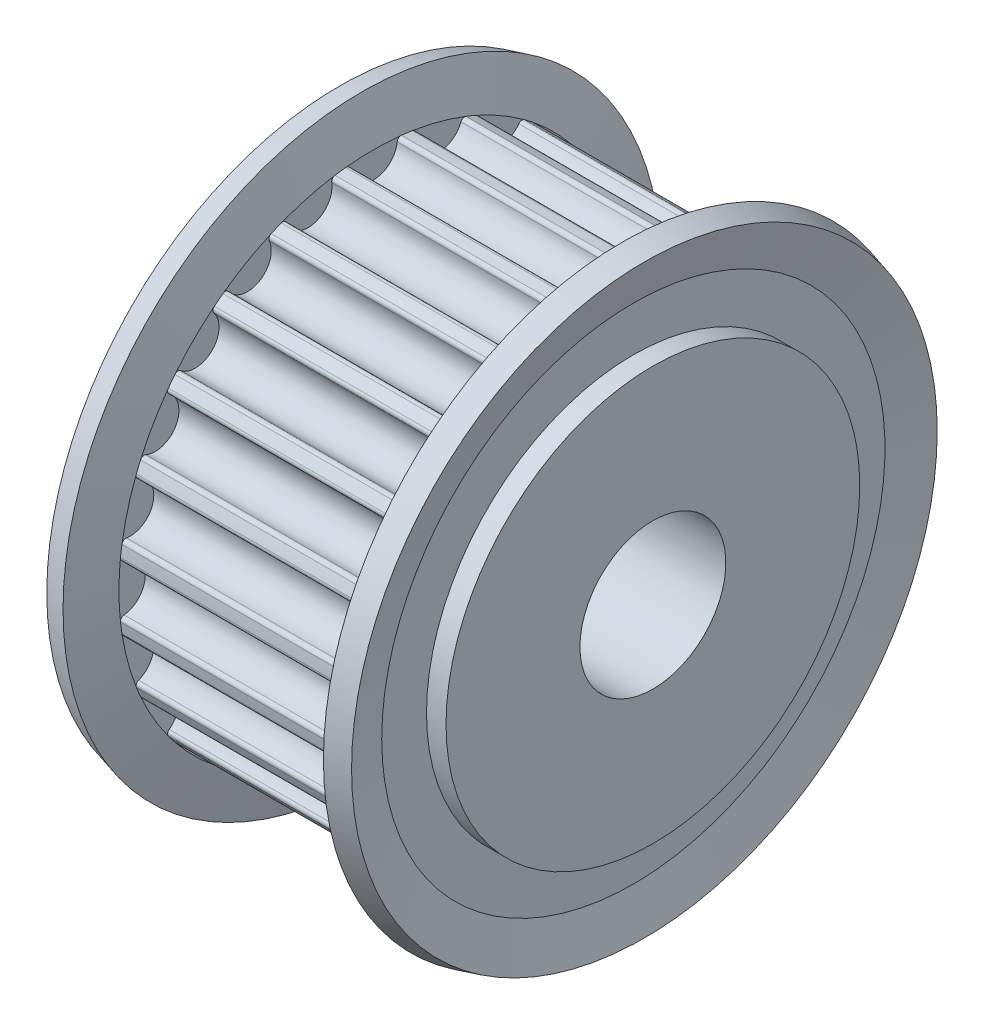
from build123d import *

# Parameters (mm, degrees)
CUT_EXTRUDE1_DEPTH       = 5.15
CUT_EXTRUDE1_DEPTH_BACK  = 5.15
CUT_EXTRUDE2_DEPTH       = 5.15
CUT_EXTRUDE2_DEPTH_BACK  = 5.15
CUT_EXTRUDE3_DEPTH       = 5.15
CUT_EXTRUDE3_DEPTH_BACK  = 5.15
CUT_EXTRUDE4_DEPTH       = 5.15
CUT_EXTRUDE4_DEPTH_BACK  = 5.15
CUT_EXTRUDE5_DEPTH       = 5.15
CUT_EXTRUDE5_DEPTH_BACK  = 5.15
CUT_EXTRUDE6_DEPTH       = 5.15
CUT_EXTRUDE6_DEPTH_BACK  = 5.15
CUT_EXTRUDE7_DEPTH       = 5.15
CUT_EXTRUDE7_DEPTH_BACK  = 5.15
CUT_EXTRUDE8_DEPTH       = 5.15
CUT_EXTRUDE8_DEPTH_BACK  = 5.15
CUT_EXTRUDE9_DEPTH       = 5.15
CUT_EXTRUDE9_DEPTH_BACK  = 5.15
CUT_EXTRUDE10_DEPTH      = 5.15
CUT_EXTRUDE10_DEPTH_BACK = 5.15
CUT_EXTRUDE11_DEPTH      = 5.15
CUT_EXTRUDE11_DEPTH_BACK = 5.15
CUT_EXTRUDE12_DEPTH      = 5.15
CUT_EXTRUDE12_DEPTH_BACK = 5.15
CUT_EXTRUDE13_DEPTH      = 5.15
CUT_EXTRUDE13_DEPTH_BACK = 5.15
CUT_EXTRUDE14_DEPTH      = 5.15
CUT_EXTRUDE14_DEPTH_BACK = 5.15
CUT_EXTRUDE15_DEPTH      = 5.15
CUT_EXTRUDE15_DEPTH_BACK = 5.15
CUT_EXTRUDE16_DEPTH      = 5.15
CUT_EXTRUDE16_DEPTH_BACK = 5.15
CUT_EXTRUDE17_DEPTH      = 5.15
CUT_EXTRUDE17_DEPTH_BACK = 5.15
CUT_EXTRUDE18_DEPTH      = 5.15
CUT_EXTRUDE18_DEPTH_BACK = 5.15
CUT_EXTRUDE19_DEPTH      = 5.15
CUT_EXTRUDE19_DEPTH_BACK = 5.15
CUT_EXTRUDE20_DEPTH      = 5.15
CUT_EXTRUDE20_DEPTH_BACK = 5.15
CUT_EXTRUDE21_DEPTH      = 5.15
CUT_EXTRUDE21_DEPTH_BACK = 5.15
CUT_EXTRUDE22_DEPTH      = 5.15
CUT_EXTRUDE22_DEPTH_BACK = 5.15
CUT_EXTRUDE23_DEPTH      = 5.15
CUT_EXTRUDE23_DEPTH_BACK = 5.15
CUT_EXTRUDE24_DEPTH      = 5.15
CUT_EXTRUDE24_DEPTH_BACK = 5.15
SKETCH26_W               = 14
SKETCH26_H               = 3.175


with BuildPart() as part:
    # Sketch1 → Revolve1 (revolve)
    with BuildSketch(Plane.XY):
        Polygon((0, 0), (0, 9), (0.85, 9), (0.85, 10.948347502), (0.369611724, 12.741180955), (1.335537551, 13), (1.85, 11.08), (12.15, 11.08), (12.664462449, 13), (13.630388276, 12.741180955), (13.15, 10.948347502), (13.15, 9), (14, 9), (14, 0), align=None)
    revolve(axis=Axis((14, 0, 0), (-1, 0, 0)))

    # Sketch2 → Cut-Extrude1 (cut, two sides: drawn at the far end of the back side and taken through both)
    with BuildSketch(Plane(origin=(7, 0, 0), x_dir=(0, 0, -1), z_dir=(1, 0, 0)).offset(-CUT_EXTRUDE1_DEPTH_BACK)):
        with BuildLine():
            Line((-1.253585937, 11.391230061), (-1.212018515, 11.01351039))
            ThreePointArc((-1.212018515, 11.01351039), (-1.086763232, 10.976907979), (-1.024354367, 10.862305378))
            ThreePointArc((-1.024354367, 10.862305378), (0, 9.94), (1.024354367, 10.862305378))
            ThreePointArc((1.024354367, 10.862305378), (1.086763232, 10.976907979), (1.212018515, 11.01351039))
            Line((1.212018515, 11.01351039), (1.253585937, 11.391230061))
            ThreePointArc((1.253585937, 11.391230061), (0, 11.46), (-1.253585937, 11.391230061))
        make_face()
    extrude(amount=CUT_EXTRUDE1_DEPTH + CUT_EXTRUDE1_DEPTH_BACK, mode=Mode.SUBTRACT)

    # Sketch3 → Cut-Extrude2 (cut, two sides: drawn at the far end of the back side and taken through both)
    with BuildSketch(Plane(origin=(7, 0, 0), x_dir=(0, 0, -1), z_dir=(1, 0, 0)).offset(-CUT_EXTRUDE2_DEPTH_BACK)):
        with BuildLine():
            Line((-4.159138319, 10.678631394), (-4.021226228, 10.324540649))
            ThreePointArc((-4.021226228, 10.324540649), (-3.890765514, 10.321603888), (-3.800821844, 10.227058879))
            ThreePointArc((-3.800821844, 10.227058879), (-2.572661308, 9.601302713), (-1.821921168, 10.757303717))
            ThreePointArc((-1.821921168, 10.757303717), (-1.791300169, 10.884153932), (-1.679786257, 10.951927599))
            Line((-1.679786257, 10.951927599), (-1.737396255, 11.327535224))
            ThreePointArc((-1.737396255, 11.327535224), (-2.966066257, 11.069509969), (-4.159138319, 10.678631394))
        make_face()
    extrude(amount=CUT_EXTRUDE2_DEPTH + CUT_EXTRUDE2_DEPTH_BACK, mode=Mode.SUBTRACT)

    # Sketch4 → Cut-Extrude3 (cut, two sides: drawn at the far end of the back side and taken through both)
    with BuildSketch(Plane(origin=(7, 0, 0), x_dir=(0, 0, -1), z_dir=(1, 0, 0)).offset(-CUT_EXTRUDE3_DEPTH_BACK)):
        with BuildLine():
            Line((-6.781252298, 9.238301645), (-6.556394019, 8.931970525))
            ThreePointArc((-6.556394019, 8.931970525), (-6.429618556, 8.962899549), (-6.318269593, 8.894855218))
            ThreePointArc((-6.318269593, 8.894855218), (-4.97, 8.608292514), (-4.544035785, 9.919209585))
            ThreePointArc((-4.544035785, 9.919209585), (-4.547289423, 10.049662781), (-4.457116371, 10.14398904))
            Line((-4.457116371, 10.14398904), (-4.609977763, 10.491887582))
            ThreePointArc((-4.609977763, 10.491887582), (-5.73, 9.924651127), (-6.781252298, 9.238301645))
        make_face()
    extrude(amount=CUT_EXTRUDE3_DEPTH + CUT_EXTRUDE3_DEPTH_BACK, mode=Mode.SUBTRACT)

    # Sketch5 → Cut-Extrude4 (cut, two sides: drawn at the far end of the back side and taken through both)
    with BuildSketch(Plane(origin=(7, 0, 0), x_dir=(0, 0, -1), z_dir=(1, 0, 0)).offset(-CUT_EXTRUDE4_DEPTH_BACK)):
        with BuildLine():
            Line((-8.941235139, 7.168396905), (-8.644754393, 6.930701371))
            ThreePointArc((-8.644754393, 6.930701371), (-8.530303719, 6.993388418), (-8.405137711, 6.956481873))
            ThreePointArc((-8.405137711, 6.956481873), (-7.028641405, 7.028641405), (-6.956481873, 8.405137711))
            ThreePointArc((-6.956481873, 8.405137711), (-6.993388418, 8.530303719), (-6.930701371, 8.644754393))
            Line((-6.930701371, 8.644754393), (-7.168396905, 8.941235139))
            ThreePointArc((-7.168396905, 8.941235139), (-8.103443712, 8.103443712), (-8.941235139, 7.168396905))
        make_face()
    extrude(amount=CUT_EXTRUDE4_DEPTH + CUT_EXTRUDE4_DEPTH_BACK, mode=Mode.SUBTRACT)

    # Sketch6 → Cut-Extrude5 (cut, two sides: drawn at the far end of the back side and taken through both)
    with BuildSketch(Plane(origin=(7, 0, 0), x_dir=(0, 0, -1), z_dir=(1, 0, 0)).offset(-CUT_EXTRUDE5_DEPTH_BACK)):
        with BuildLine():
            Line((-10.491887582, 4.609977763), (-10.14398904, 4.457116371))
            ThreePointArc((-10.14398904, 4.457116371), (-10.049662781, 4.547289423), (-9.919209585, 4.544035785))
            ThreePointArc((-9.919209585, 4.544035785), (-8.608292514, 4.97), (-8.894855218, 6.318269593))
            ThreePointArc((-8.894855218, 6.318269593), (-8.962899549, 6.429618556), (-8.931970525, 6.556394019))
            Line((-8.931970525, 6.556394019), (-9.238301645, 6.781252298))
            ThreePointArc((-9.238301645, 6.781252298), (-9.924651127, 5.73), (-10.491887582, 4.609977763))
        make_face()
    extrude(amount=CUT_EXTRUDE5_DEPTH + CUT_EXTRUDE5_DEPTH_BACK, mode=Mode.SUBTRACT)

    # Sketch7 → Cut-Extrude6 (cut, two sides: drawn at the far end of the back side and taken through both)
    with BuildSketch(Plane(origin=(7, 0, 0), x_dir=(0, 0, -1), z_dir=(1, 0, 0)).offset(-CUT_EXTRUDE6_DEPTH_BACK)):
        with BuildLine():
            Line((-11.327535224, 1.737396255), (-10.951927599, 1.679786257))
            ThreePointArc((-10.951927599, 1.679786257), (-10.884153932, 1.791300169), (-10.757303717, 1.821921168))
            ThreePointArc((-10.757303717, 1.821921168), (-9.601302713, 2.572661308), (-10.227058879, 3.800821844))
            ThreePointArc((-10.227058879, 3.800821844), (-10.321603888, 3.890765514), (-10.324540649, 4.021226228))
            Line((-10.324540649, 4.021226228), (-10.678631394, 4.159138319))
            ThreePointArc((-10.678631394, 4.159138319), (-11.069509969, 2.966066257), (-11.327535224, 1.737396255))
        make_face()
    extrude(amount=CUT_EXTRUDE6_DEPTH + CUT_EXTRUDE6_DEPTH_BACK, mode=Mode.SUBTRACT)

    # Sketch8 → Cut-Extrude7 (cut, two sides: drawn at the far end of the back side and taken through both)
    with BuildSketch(Plane(origin=(7, 0, 0), x_dir=(0, 0, -1), z_dir=(1, 0, 0)).offset(-CUT_EXTRUDE7_DEPTH_BACK)):
        with BuildLine():
            Line((-11.391230061, -1.253585937), (-11.01351039, -1.212018515))
            ThreePointArc((-11.01351039, -1.212018515), (-10.976907979, -1.086763232), (-10.862305378, -1.024354367))
            ThreePointArc((-10.862305378, -1.024354367), (-9.94, 0), (-10.862305378, 1.024354367))
            ThreePointArc((-10.862305378, 1.024354367), (-10.976907979, 1.086763232), (-11.01351039, 1.212018515))
            Line((-11.01351039, 1.212018515), (-11.391230061, 1.253585937))
            ThreePointArc((-11.391230061, 1.253585937), (-11.46, 0), (-11.391230061, -1.253585937))
        make_face()
    extrude(amount=CUT_EXTRUDE7_DEPTH + CUT_EXTRUDE7_DEPTH_BACK, mode=Mode.SUBTRACT)

    # Sketch9 → Cut-Extrude8 (cut, two sides: drawn at the far end of the back side and taken through both)
    with BuildSketch(Plane(origin=(7, 0, 0), x_dir=(0, 0, -1), z_dir=(1, 0, 0)).offset(-CUT_EXTRUDE8_DEPTH_BACK)):
        with BuildLine():
            Line((-10.678631394, -4.159138319), (-10.324540649, -4.021226228))
            ThreePointArc((-10.324540649, -4.021226228), (-10.321603888, -3.890765514), (-10.227058879, -3.800821844))
            ThreePointArc((-10.227058879, -3.800821844), (-9.601302713, -2.572661308), (-10.757303717, -1.821921168))
            ThreePointArc((-10.757303717, -1.821921168), (-10.884153932, -1.791300169), (-10.951927599, -1.679786257))
            Line((-10.951927599, -1.679786257), (-11.327535224, -1.737396255))
            ThreePointArc((-11.327535224, -1.737396255), (-11.069509969, -2.966066257), (-10.678631394, -4.159138319))
        make_face()
    extrude(amount=CUT_EXTRUDE8_DEPTH + CUT_EXTRUDE8_DEPTH_BACK, mode=Mode.SUBTRACT)

    # Sketch10 → Cut-Extrude9 (cut, two sides: drawn at the far end of the back side and taken through both)
    with BuildSketch(Plane(origin=(7, 0, 0), x_dir=(0, 0, -1), z_dir=(1, 0, 0)).offset(-CUT_EXTRUDE9_DEPTH_BACK)):
        with BuildLine():
            Line((-9.238301645, -6.781252298), (-8.931970525, -6.556394019))
            ThreePointArc((-8.931970525, -6.556394019), (-8.962899549, -6.429618556), (-8.894855218, -6.318269593))
            ThreePointArc((-8.894855218, -6.318269593), (-8.608292514, -4.97), (-9.919209585, -4.544035785))
            ThreePointArc((-9.919209585, -4.544035785), (-10.049662781, -4.547289423), (-10.14398904, -4.457116371))
            Line((-10.14398904, -4.457116371), (-10.491887582, -4.609977763))
            ThreePointArc((-10.491887582, -4.609977763), (-9.924651127, -5.73), (-9.238301645, -6.781252298))
        make_face()
    extrude(amount=CUT_EXTRUDE9_DEPTH + CUT_EXTRUDE9_DEPTH_BACK, mode=Mode.SUBTRACT)

    # Sketch11 → Cut-Extrude10 (cut, two sides: drawn at the far end of the back side and taken through both)
    with BuildSketch(Plane(origin=(7, 0, 0), x_dir=(0, 0, -1), z_dir=(1, 0, 0)).offset(-CUT_EXTRUDE10_DEPTH_BACK)):
        with BuildLine():
            Line((-7.168396905, -8.941235139), (-6.930701371, -8.644754393))
            ThreePointArc((-6.930701371, -8.644754393), (-6.993388418, -8.530303719), (-6.956481873, -8.405137711))
            ThreePointArc((-6.956481873, -8.405137711), (-7.028641405, -7.028641405), (-8.405137711, -6.956481873))
            ThreePointArc((-8.405137711, -6.956481873), (-8.530303719, -6.993388418), (-8.644754393, -6.930701371))
            Line((-8.644754393, -6.930701371), (-8.941235139, -7.168396905))
            ThreePointArc((-8.941235139, -7.168396905), (-8.103443712, -8.103443712), (-7.168396905, -8.941235139))
        make_face()
    extrude(amount=CUT_EXTRUDE10_DEPTH + CUT_EXTRUDE10_DEPTH_BACK, mode=Mode.SUBTRACT)

    # Sketch12 → Cut-Extrude11 (cut, two sides: drawn at the far end of the back side and taken through both)
    with BuildSketch(Plane(origin=(7, 0, 0), x_dir=(0, 0, -1), z_dir=(1, 0, 0)).offset(-CUT_EXTRUDE11_DEPTH_BACK)):
        with BuildLine():
            Line((-4.609977763, -10.491887582), (-4.457116371, -10.14398904))
            ThreePointArc((-4.457116371, -10.14398904), (-4.547289423, -10.049662781), (-4.544035785, -9.919209585))
            ThreePointArc((-4.544035785, -9.919209585), (-4.97, -8.608292514), (-6.318269593, -8.894855218))
            ThreePointArc((-6.318269593, -8.894855218), (-6.429618556, -8.962899549), (-6.556394019, -8.931970525))
            Line((-6.556394019, -8.931970525), (-6.781252298, -9.238301645))
            ThreePointArc((-6.781252298, -9.238301645), (-5.73, -9.924651127), (-4.609977763, -10.491887582))
        make_face()
    extrude(amount=CUT_EXTRUDE11_DEPTH + CUT_EXTRUDE11_DEPTH_BACK, mode=Mode.SUBTRACT)

    # Sketch13 → Cut-Extrude12 (cut, two sides: drawn at the far end of the back side and taken through both)
    with BuildSketch(Plane(origin=(7, 0, 0), x_dir=(0, 0, -1), z_dir=(1, 0, 0)).offset(-CUT_EXTRUDE12_DEPTH_BACK)):
        with BuildLine():
            Line((-1.737396255, -11.327535224), (-1.679786257, -10.951927599))
            ThreePointArc((-1.679786257, -10.951927599), (-1.791300169, -10.884153932), (-1.821921168, -10.757303717))
            ThreePointArc((-1.821921168, -10.757303717), (-2.572661308, -9.601302713), (-3.800821844, -10.227058879))
            ThreePointArc((-3.800821844, -10.227058879), (-3.890765514, -10.321603888), (-4.021226228, -10.324540649))
            Line((-4.021226228, -10.324540649), (-4.159138319, -10.678631394))
            ThreePointArc((-4.159138319, -10.678631394), (-2.966066257, -11.069509969), (-1.737396255, -11.327535224))
        make_face()
    extrude(amount=CUT_EXTRUDE12_DEPTH + CUT_EXTRUDE12_DEPTH_BACK, mode=Mode.SUBTRACT)

    # Sketch14 → Cut-Extrude13 (cut, two sides: drawn at the far end of the back side and taken through both)
    with BuildSketch(Plane(origin=(7, 0, 0), x_dir=(0, 0, -1), z_dir=(1, 0, 0)).offset(-CUT_EXTRUDE13_DEPTH_BACK)):
        with BuildLine():
            Line((1.253585937, -11.391230061), (1.212018515, -11.01351039))
            ThreePointArc((1.212018515, -11.01351039), (1.086763232, -10.976907979), (1.024354367, -10.862305378))
            ThreePointArc((1.024354367, -10.862305378), (0, -9.94), (-1.024354367, -10.862305378))
            ThreePointArc((-1.024354367, -10.862305378), (-1.086763232, -10.976907979), (-1.212018515, -11.01351039))
            Line((-1.212018515, -11.01351039), (-1.253585937, -11.391230061))
            ThreePointArc((-1.253585937, -11.391230061), (0, -11.46), (1.253585937, -11.391230061))
        make_face()
    extrude(amount=CUT_EXTRUDE13_DEPTH + CUT_EXTRUDE13_DEPTH_BACK, mode=Mode.SUBTRACT)

    # Sketch15 → Cut-Extrude14 (cut, two sides: drawn at the far end of the back side and taken through both)
    with BuildSketch(Plane(origin=(7, 0, 0), x_dir=(0, 0, -1), z_dir=(1, 0, 0)).offset(-CUT_EXTRUDE14_DEPTH_BACK)):
        with BuildLine():
            Line((4.159138319, -10.678631394), (4.021226228, -10.324540649))
            ThreePointArc((4.021226228, -10.324540649), (3.890765514, -10.321603888), (3.800821844, -10.227058879))
            ThreePointArc((3.800821844, -10.227058879), (2.572661308, -9.601302713), (1.821921168, -10.757303717))
            ThreePointArc((1.821921168, -10.757303717), (1.791300169, -10.884153932), (1.679786257, -10.951927599))
            Line((1.679786257, -10.951927599), (1.737396255, -11.327535224))
            ThreePointArc((1.737396255, -11.327535224), (2.966066257, -11.069509969), (4.159138319, -10.678631394))
        make_face()
    extrude(amount=CUT_EXTRUDE14_DEPTH + CUT_EXTRUDE14_DEPTH_BACK, mode=Mode.SUBTRACT)

    # Sketch16 → Cut-Extrude15 (cut, two sides: drawn at the far end of the back side and taken through both)
    with BuildSketch(Plane(origin=(7, 0, 0), x_dir=(0, 0, -1), z_dir=(1, 0, 0)).offset(-CUT_EXTRUDE15_DEPTH_BACK)):
        with BuildLine():
            Line((6.781252298, -9.238301645), (6.556394019, -8.931970525))
            ThreePointArc((6.556394019, -8.931970525), (6.429618556, -8.962899549), (6.318269593, -8.894855218))
            ThreePointArc((6.318269593, -8.894855218), (4.97, -8.608292514), (4.544035785, -9.919209585))
            ThreePointArc((4.544035785, -9.919209585), (4.547289423, -10.049662781), (4.457116371, -10.14398904))
            Line((4.457116371, -10.14398904), (4.609977763, -10.491887582))
            ThreePointArc((4.609977763, -10.491887582), (5.73, -9.924651127), (6.781252298, -9.238301645))
        make_face()
    extrude(amount=CUT_EXTRUDE15_DEPTH + CUT_EXTRUDE15_DEPTH_BACK, mode=Mode.SUBTRACT)

    # Sketch17 → Cut-Extrude16 (cut, two sides: drawn at the far end of the back side and taken through both)
    with BuildSketch(Plane(origin=(7, 0, 0), x_dir=(0, 0, -1), z_dir=(1, 0, 0)).offset(-CUT_EXTRUDE16_DEPTH_BACK)):
        with BuildLine():
            Line((8.941235139, -7.168396905), (8.644754393, -6.930701371))
            ThreePointArc((8.644754393, -6.930701371), (8.530303719, -6.993388418), (8.405137711, -6.956481873))
            ThreePointArc((8.405137711, -6.956481873), (7.028641405, -7.028641405), (6.956481873, -8.405137711))
            ThreePointArc((6.956481873, -8.405137711), (6.993388418, -8.530303719), (6.930701371, -8.644754393))
            Line((6.930701371, -8.644754393), (7.168396905, -8.941235139))
            ThreePointArc((7.168396905, -8.941235139), (8.103443712, -8.103443712), (8.941235139, -7.168396905))
        make_face()
    extrude(amount=CUT_EXTRUDE16_DEPTH + CUT_EXTRUDE16_DEPTH_BACK, mode=Mode.SUBTRACT)

    # Sketch18 → Cut-Extrude17 (cut, two sides: drawn at the far end of the back side and taken through both)
    with BuildSketch(Plane(origin=(7, 0, 0), x_dir=(0, 0, -1), z_dir=(1, 0, 0)).offset(-CUT_EXTRUDE17_DEPTH_BACK)):
        with BuildLine():
            Line((10.491887582, -4.609977763), (10.14398904, -4.457116371))
            ThreePointArc((10.14398904, -4.457116371), (10.049662781, -4.547289423), (9.919209585, -4.544035785))
            ThreePointArc((9.919209585, -4.544035785), (8.608292514, -4.97), (8.894855218, -6.318269593))
            ThreePointArc((8.894855218, -6.318269593), (8.962899549, -6.429618556), (8.931970525, -6.556394019))
            Line((8.931970525, -6.556394019), (9.238301645, -6.781252298))
            ThreePointArc((9.238301645, -6.781252298), (9.924651127, -5.73), (10.491887582, -4.609977763))
        make_face()
    extrude(amount=CUT_EXTRUDE17_DEPTH + CUT_EXTRUDE17_DEPTH_BACK, mode=Mode.SUBTRACT)

    # Sketch19 → Cut-Extrude18 (cut, two sides: drawn at the far end of the back side and taken through both)
    with BuildSketch(Plane(origin=(7, 0, 0), x_dir=(0, 0, -1), z_dir=(1, 0, 0)).offset(-CUT_EXTRUDE18_DEPTH_BACK)):
        with BuildLine():
            Line((11.327535224, -1.737396255), (10.951927599, -1.679786257))
            ThreePointArc((10.951927599, -1.679786257), (10.884153932, -1.791300169), (10.757303717, -1.821921168))
            ThreePointArc((10.757303717, -1.821921168), (9.601302713, -2.572661308), (10.227058879, -3.800821844))
            ThreePointArc((10.227058879, -3.800821844), (10.321603888, -3.890765514), (10.324540649, -4.021226228))
            Line((10.324540649, -4.021226228), (10.678631394, -4.159138319))
            ThreePointArc((10.678631394, -4.159138319), (11.069509969, -2.966066257), (11.327535224, -1.737396255))
        make_face()
    extrude(amount=CUT_EXTRUDE18_DEPTH + CUT_EXTRUDE18_DEPTH_BACK, mode=Mode.SUBTRACT)

    # Sketch20 → Cut-Extrude19 (cut, two sides: drawn at the far end of the back side and taken through both)
    with BuildSketch(Plane(origin=(7, 0, 0), x_dir=(0, 0, -1), z_dir=(1, 0, 0)).offset(-CUT_EXTRUDE19_DEPTH_BACK)):
        with BuildLine():
            Line((11.391230061, 1.253585937), (11.01351039, 1.212018515))
            ThreePointArc((11.01351039, 1.212018515), (10.976907979, 1.086763232), (10.862305378, 1.024354367))
            ThreePointArc((10.862305378, 1.024354367), (9.94, 0), (10.862305378, -1.024354367))
            ThreePointArc((10.862305378, -1.024354367), (10.976907979, -1.086763232), (11.01351039, -1.212018515))
            Line((11.01351039, -1.212018515), (11.391230061, -1.253585937))
            ThreePointArc((11.391230061, -1.253585937), (11.46, 0), (11.391230061, 1.253585937))
        make_face()
    extrude(amount=CUT_EXTRUDE19_DEPTH + CUT_EXTRUDE19_DEPTH_BACK, mode=Mode.SUBTRACT)

    # Sketch21 → Cut-Extrude20 (cut, two sides: drawn at the far end of the back side and taken through both)
    with BuildSketch(Plane(origin=(7, 0, 0), x_dir=(0, 0, -1), z_dir=(1, 0, 0)).offset(-CUT_EXTRUDE20_DEPTH_BACK)):
        with BuildLine():
            Line((10.678631394, 4.159138319), (10.324540649, 4.021226228))
            ThreePointArc((10.324540649, 4.021226228), (10.321603888, 3.890765514), (10.227058879, 3.800821844))
            ThreePointArc((10.227058879, 3.800821844), (9.601302713, 2.572661308), (10.757303717, 1.821921168))
            ThreePointArc((10.757303717, 1.821921168), (10.884153932, 1.791300169), (10.951927599, 1.679786257))
            Line((10.951927599, 1.679786257), (11.327535224, 1.737396255))
            ThreePointArc((11.327535224, 1.737396255), (11.069509969, 2.966066257), (10.678631394, 4.159138319))
        make_face()
    extrude(amount=CUT_EXTRUDE20_DEPTH + CUT_EXTRUDE20_DEPTH_BACK, mode=Mode.SUBTRACT)

    # Sketch22 → Cut-Extrude21 (cut, two sides: drawn at the far end of the back side and taken through both)
    with BuildSketch(Plane(origin=(7, 0, 0), x_dir=(0, 0, -1), z_dir=(1, 0, 0)).offset(-CUT_EXTRUDE21_DEPTH_BACK)):
        with BuildLine():
            Line((9.238301645, 6.781252298), (8.931970525, 6.556394019))
            ThreePointArc((8.931970525, 6.556394019), (8.962899549, 6.429618556), (8.894855218, 6.318269593))
            ThreePointArc((8.894855218, 6.318269593), (8.608292514, 4.97), (9.919209585, 4.544035785))
            ThreePointArc((9.919209585, 4.544035785), (10.049662781, 4.547289423), (10.14398904, 4.457116371))
            Line((10.14398904, 4.457116371), (10.491887582, 4.609977763))
            ThreePointArc((10.491887582, 4.609977763), (9.924651127, 5.73), (9.238301645, 6.781252298))
        make_face()
    extrude(amount=CUT_EXTRUDE21_DEPTH + CUT_EXTRUDE21_DEPTH_BACK, mode=Mode.SUBTRACT)

    # Sketch23 → Cut-Extrude22 (cut, two sides: drawn at the far end of the back side and taken through both)
    with BuildSketch(Plane(origin=(7, 0, 0), x_dir=(0, 0, -1), z_dir=(1, 0, 0)).offset(-CUT_EXTRUDE22_DEPTH_BACK)):
        with BuildLine():
            Line((7.168396905, 8.941235139), (6.930701371, 8.644754393))
            ThreePointArc((6.930701371, 8.644754393), (6.993388418, 8.530303719), (6.956481873, 8.405137711))
            ThreePointArc((6.956481873, 8.405137711), (7.028641405, 7.028641405), (8.405137711, 6.956481873))
            ThreePointArc((8.405137711, 6.956481873), (8.530303719, 6.993388418), (8.644754393, 6.930701371))
            Line((8.644754393, 6.930701371), (8.941235139, 7.168396905))
            ThreePointArc((8.941235139, 7.168396905), (8.103443712, 8.103443712), (7.168396905, 8.941235139))
        make_face()
    extrude(amount=CUT_EXTRUDE22_DEPTH + CUT_EXTRUDE22_DEPTH_BACK, mode=Mode.SUBTRACT)

    # Sketch24 → Cut-Extrude23 (cut, two sides: drawn at the far end of the back side and taken through both)
    with BuildSketch(Plane(origin=(7, 0, 0), x_dir=(0, 0, -1), z_dir=(1, 0, 0)).offset(-CUT_EXTRUDE23_DEPTH_BACK)):
        with BuildLine():
            Line((4.609977763, 10.491887582), (4.457116371, 10.14398904))
            ThreePointArc((4.457116371, 10.14398904), (4.547289423, 10.049662781), (4.544035785, 9.919209585))
            ThreePointArc((4.544035785, 9.919209585), (4.97, 8.608292514), (6.318269593, 8.894855218))
            ThreePointArc((6.318269593, 8.894855218), (6.429618556, 8.962899549), (6.556394019, 8.931970525))
            Line((6.556394019, 8.931970525), (6.781252298, 9.238301645))
            ThreePointArc((6.781252298, 9.238301645), (5.73, 9.924651127), (4.609977763, 10.491887582))
        make_face()
    extrude(amount=CUT_EXTRUDE23_DEPTH + CUT_EXTRUDE23_DEPTH_BACK, mode=Mode.SUBTRACT)

    # Sketch25 → Cut-Extrude24 (cut, two sides: drawn at the far end of the back side and taken through both)
    with BuildSketch(Plane(origin=(7, 0, 0), x_dir=(0, 0, -1), z_dir=(1, 0, 0)).offset(-CUT_EXTRUDE24_DEPTH_BACK)):
        with BuildLine():
            Line((1.737396255, 11.327535224), (1.679786257, 10.951927599))
            ThreePointArc((1.679786257, 10.951927599), (1.791300169, 10.884153932), (1.821921168, 10.757303717))
            ThreePointArc((1.821921168, 10.757303717), (2.572661308, 9.601302713), (3.800821844, 10.227058879))
            ThreePointArc((3.800821844, 10.227058879), (3.890765514, 10.321603888), (4.021226228, 10.324540649))
            Line((4.021226228, 10.324540649), (4.159138319, 10.678631394))
            ThreePointArc((4.159138319, 10.678631394), (2.966066257, 11.069509969), (1.737396255, 11.327535224))
        make_face()
    extrude(amount=CUT_EXTRUDE24_DEPTH + CUT_EXTRUDE24_DEPTH_BACK, mode=Mode.SUBTRACT)

    # Sketch26 → Cut-Revolve1 (revolve, cut)
    with BuildSketch(Plane.XY):
        with Locations((7, 1.5875)):
            Rectangle(SKETCH26_W, SKETCH26_H)
    revolve(axis=Axis((14, 0, 0), (-1, 0, 0)), mode=Mode.SUBTRACT)


solid = part.part
